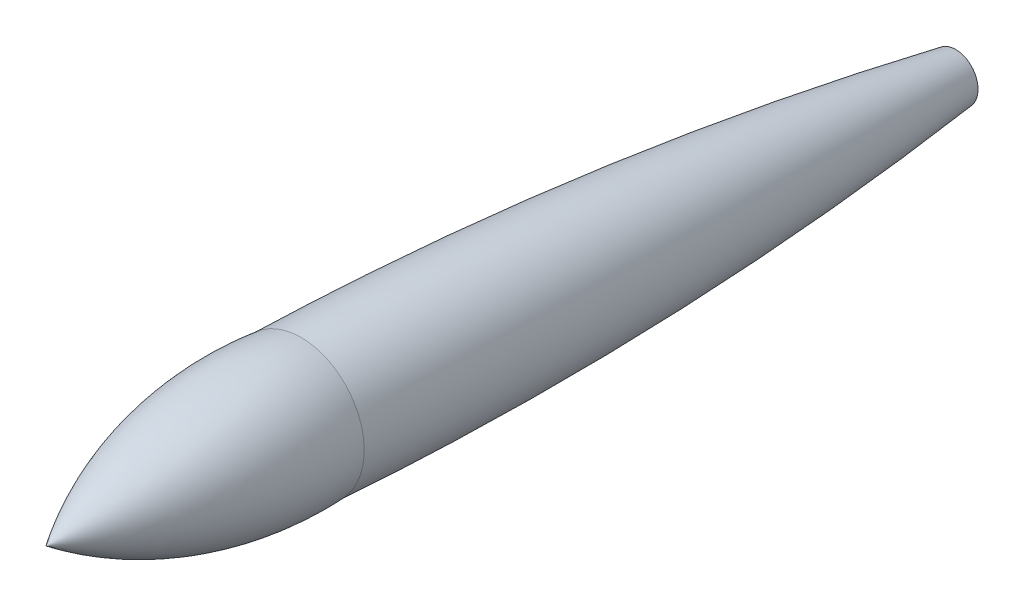
from build123d import *


with BuildPart() as part:
    # Sketch3 → Revolve1 (revolve)
    with BuildSketch(Plane(origin=(0, 0, 0), x_dir=(0, 0, -1), z_dir=(1, 0, 0)), mode=Mode.PRIVATE) as revolve1_sk:
        with BuildLine():
            Line((0.554813755, -2.691227484), (0, 0))
            Line((0, 0), (-102.073693854, 5.438025729))
            ThreePointArc((-102.073693854, 5.438025729), (-88.811511313, -1.473187753), (-74.006355718, -3.584520353))
            ThreePointArc((-74.006355718, -3.584520353), (-36.70790053, -4.629480796), (0.554813755, -2.691227484))
        make_face()
    revolve(revolve1_sk.sketch.rotate(Axis((0, 0, 0), (0, 0.05320004205156211, 0.9985838750579303)), 180), axis=Axis((0, 0, 0), (0, 0.05320004205156211, 0.9985838750579303)))


solid = part.part
